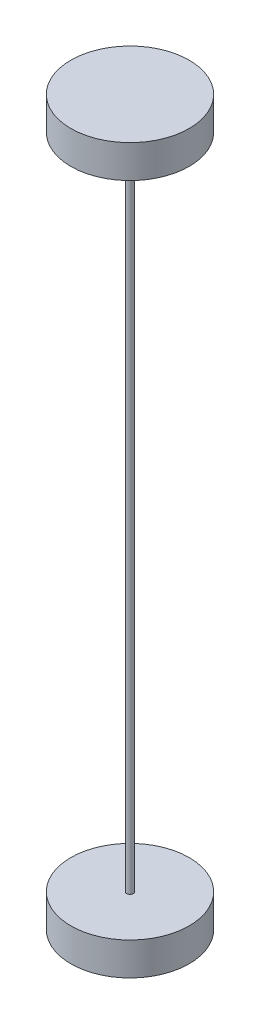
from build123d import *

# Parameters (mm, degrees)
SKETCH_1_R      = 18
EXTRUDE_1_DEPTH = 10
SKETCH_2_R      = 1
EXTRUDE_2_DEPTH = 200
EXTRUDE_START   = 10
SKETCH_3_R      = 18
EXTRUDE_3_DEPTH = 10


with BuildPart() as part:
    # 草图1 → 凸台-拉伸1 (new body)
    with BuildSketch(Plane(origin=(0, 0, 0), x_dir=(1, 0, 0), z_dir=(0, 1, 0))):
        with Locations(Location((0, 0, 0), (0, 0, 270))):
            Circle(SKETCH_1_R)
    extrude(amount=EXTRUDE_1_DEPTH)

    # 草图2 → 凸台-拉伸2 (add)
    with BuildSketch(Plane(origin=(0, 0, 0), x_dir=(-1, 0, 0), z_dir=(0, -1, 0))):
        with Locations(Location((0, 0, 0), (0, 0, 270))):
            Circle(SKETCH_2_R)
    extrude(amount=EXTRUDE_2_DEPTH)

    # 草图3 → 凸台-拉伸3 (add)
    with BuildSketch(Plane(origin=(0, -200, 0), x_dir=(-1, 0, 0), z_dir=(0, -1, 0)).offset(EXTRUDE_START)):
        with Locations(Location((0, 0, 0), (0, 0, 270))):
            Circle(SKETCH_3_R)
    extrude(amount=-EXTRUDE_3_DEPTH)


solid = part.part
